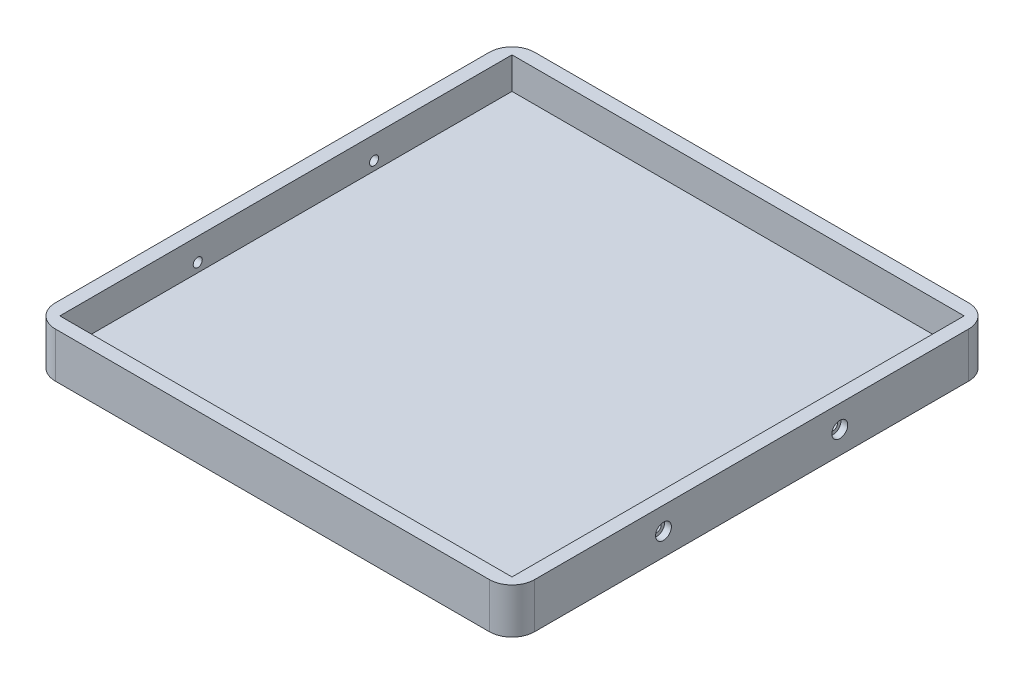
from build123d import *

# Parameters (mm, degrees)
SKETCH1_W           = 106
SKETCH1_H           = 106
BOSS_EXTRUDE1_DEPTH = 10
SKETCH3_W           = 100
SKETCH3_H           = 100
CUT_EXTRUDE5_DEPTH  = 7
CUT_EXTRUDE9_DEPTH  = 1.5
SKETCH14_R          = 1
CUT_EXTRUDE10_DEPTH = 115.5
CUT_EXTRUDE11_START = -1.5
SKETCH15_R          = 1.75
CUT_EXTRUDE11_DEPTH = 1.5
FILLET1_R           = 5


with BuildPart() as part:
    # Sketch1 → Boss-Extrude1 (new body)
    with BuildSketch(Plane(origin=(0, 0, 0), x_dir=(1, 0, 0), z_dir=(0, 1, 0))):
        Rectangle(SKETCH1_W, SKETCH1_H)
    extrude(amount=BOSS_EXTRUDE1_DEPTH)

    # Sketch3 → Cut-Extrude5 (cut)
    with BuildSketch(Plane(origin=(0, 10, 0), x_dir=(1, 0, 0), z_dir=(0, 1, 0))):
        Rectangle(SKETCH3_W, SKETCH3_H)
    extrude(amount=-CUT_EXTRUDE5_DEPTH, mode=Mode.SUBTRACT)

    # Sketch12 → Cut-Extrude9 (cut)
    with BuildSketch(Plane(origin=(53, 0, 0), x_dir=(0, 0, -1), z_dir=(1, 0, 0))):
        with BuildLine():
            ThreePointArc((-17.75, 5), (-18.262563133, 6.237436867), (-19.5, 6.75))
            Line((-19.5, 6.75), (-19.5, 3.25))
            ThreePointArc((-19.5, 3.25), (-18.262563133, 3.762563133), (-17.75, 5))
        make_face()
        with BuildLine():
            Line((-19.5, 3.25), (-19.5, 6.75))
            ThreePointArc((-19.5, 6.75), (-21.25, 5), (-19.5, 3.25))
        make_face()
        with BuildLine():
            ThreePointArc((21.25, 5), (20.737436867, 6.237436867), (19.5, 6.75))
            Line((19.5, 6.75), (19.5, 3.25))
            ThreePointArc((19.5, 3.25), (20.737436867, 3.762563133), (21.25, 5))
        make_face()
        with BuildLine():
            Line((19.5, 3.25), (19.5, 6.75))
            ThreePointArc((19.5, 6.75), (17.75, 5), (19.5, 3.25))
        make_face()
    extrude(amount=-CUT_EXTRUDE9_DEPTH, mode=Mode.SUBTRACT)

    # Sketch14 → Cut-Extrude10 (cut)
    with BuildSketch(Plane(origin=(51.5, 0, 0), x_dir=(0, 0, -1), z_dir=(1, 0, 0))):
        with Locations((-19.5, 5)):
            Circle(SKETCH14_R)
        with Locations((19.5, 5)):
            Circle(SKETCH14_R)
    extrude(amount=-CUT_EXTRUDE10_DEPTH, mode=Mode.SUBTRACT)

    # Sketch15 → Cut-Extrude11 (cut)
    with BuildSketch(Plane.ZY.offset(53).offset(CUT_EXTRUDE11_START)):
        with Locations(Location((-19.5, 5, 0), (0, 0, 180))):
            Circle(SKETCH15_R)
        with Locations(Location((19.5, 5, 0), (0, 0, 180))):
            Circle(SKETCH15_R)
    extrude(amount=CUT_EXTRUDE11_DEPTH, mode=Mode.SUBTRACT)

    # Fillet1
    fillet1_edges = [part.edges().sort_by_distance(p)[0] for p in [
        (53, 5, 53),
        (-53, 5, 53),
        (-53, 5, -53),
        (53, 5, -53),
    ]]
    fillet(fillet1_edges, radius=FILLET1_R)


solid = part.part
